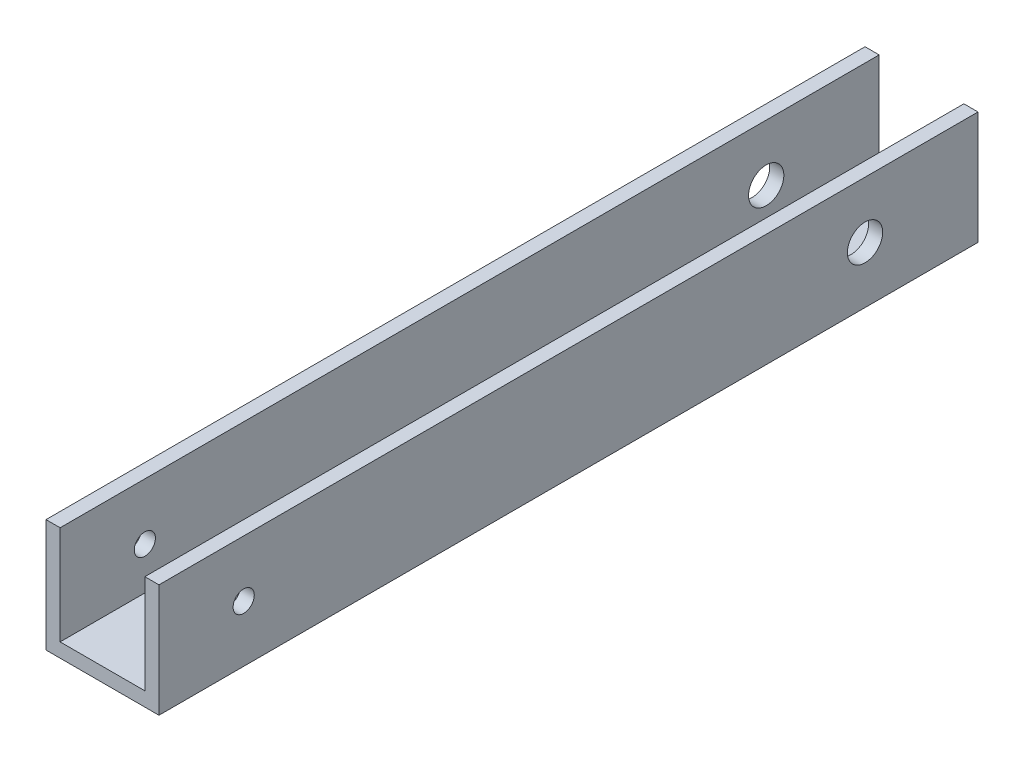
from build123d import *

# Parameters (mm, degrees)
BOSS_EXTRUDE1_DEPTH = 184.15
SKETCH2_R           = 2.38125
SKETCH2_R_2         = 3.96875
CUT_EXTRUDE1_DEPTH  = 25.4


with BuildPart() as part:
    # Sketch1 → Boss-Extrude1 (new body)
    with BuildSketch(Plane.XY):
        Polygon((0, 0), (25.4, 0), (25.4, 25.4), (22.225, 25.4), (22.225, 3.175), (3.175, 3.175), (3.175, 25.4), (0, 25.4), align=None)
    extrude(amount=BOSS_EXTRUDE1_DEPTH)

    # Sketch2 → Cut-Extrude1 (cut)
    with BuildSketch(Plane(origin=(25.4, 0, 0), x_dir=(0, 0, -1), z_dir=(1, 0, 0))):
        with Locations((-165.1, 12.7)):
            Circle(SKETCH2_R)
        with Locations((-25.4, 12.7)):
            Circle(SKETCH2_R_2)
    extrude(amount=-CUT_EXTRUDE1_DEPTH, mode=Mode.SUBTRACT)


solid = part.part
